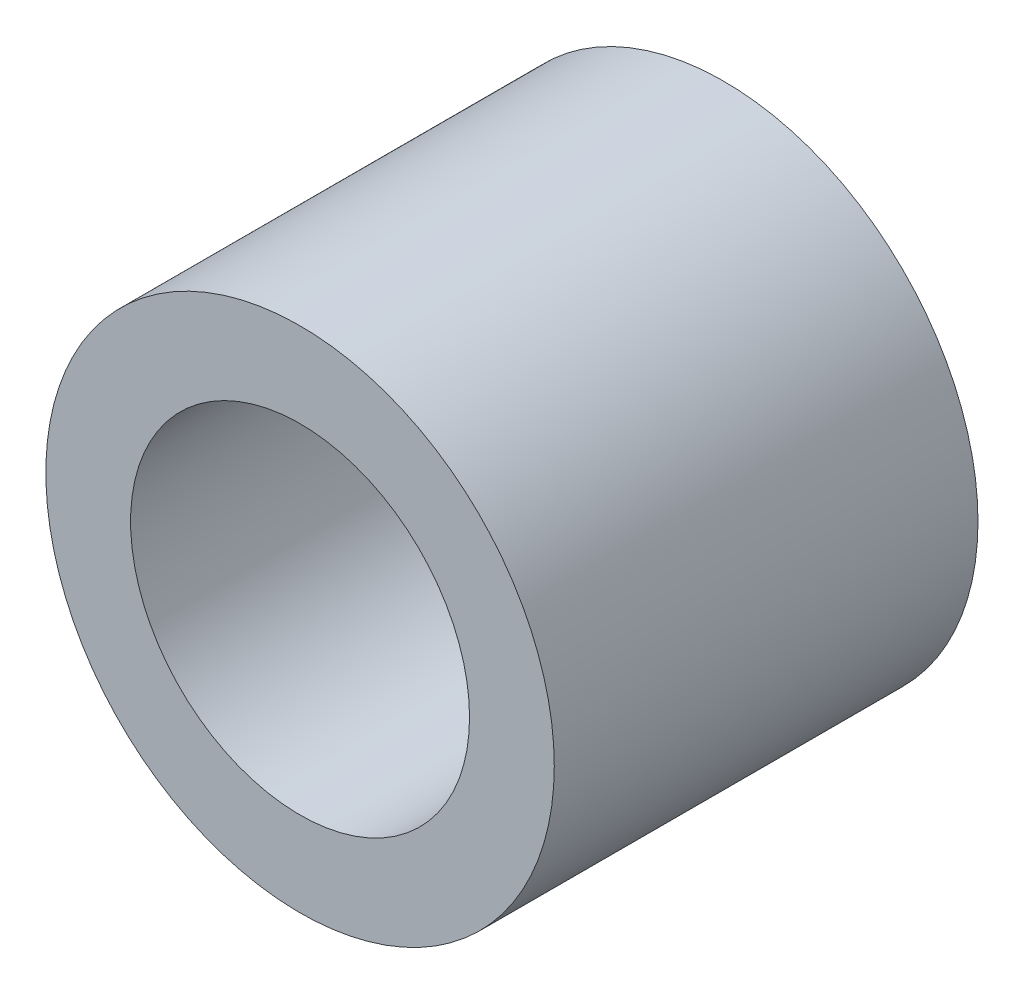
from build123d import *

# Parameters (mm, degrees)
SKETCH1_R           = 152.4
SKETCH1_R_2         = 101.6
BOSS_EXTRUDE1_DEPTH = 127


with BuildPart() as part:
    # Sketch1 → Boss-Extrude1 (new, symmetric)
    with BuildSketch(Plane.XY):
        Circle(SKETCH1_R)
        Circle(SKETCH1_R_2, mode=Mode.SUBTRACT)
    extrude(amount=BOSS_EXTRUDE1_DEPTH, both=True)


solid = part.part
